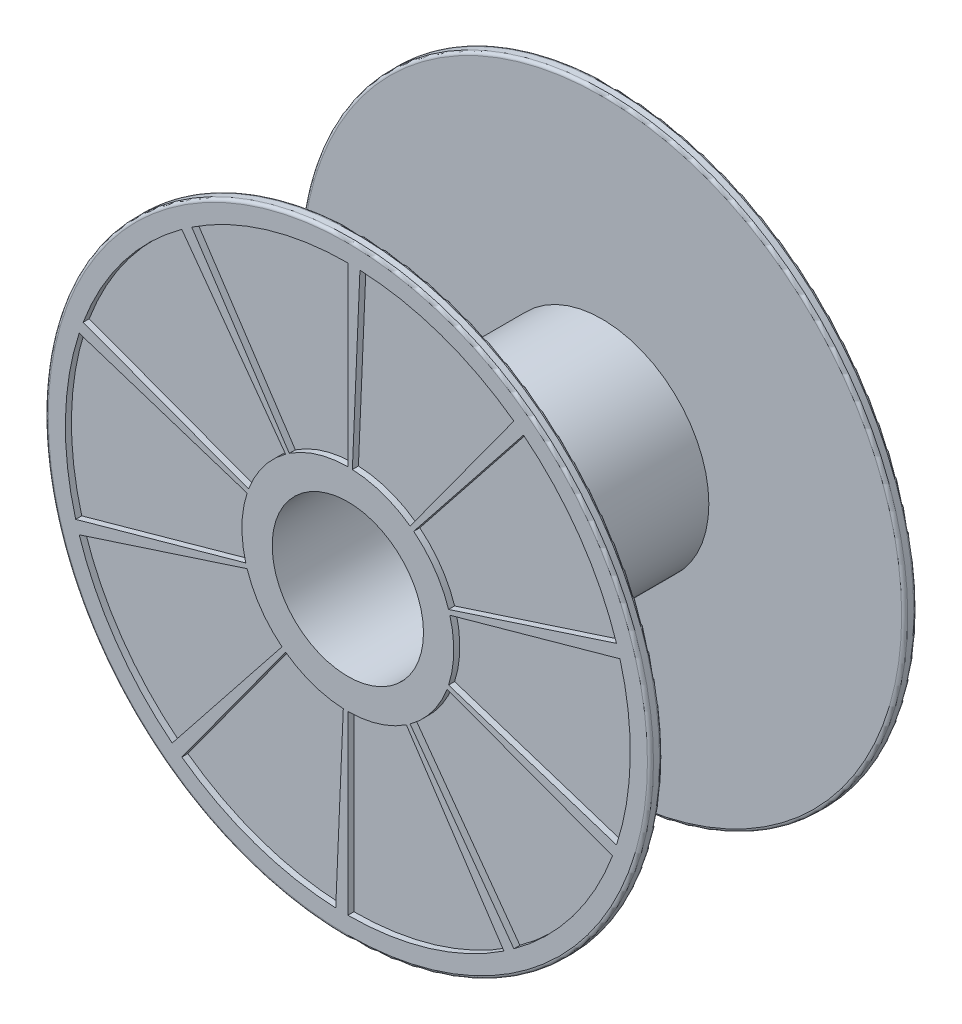
from build123d import *

# Parameters (mm, degrees)
SKICA1_R                 = 100
SKICA1_R_2               = 25
P_IDAT_VYSUNUT_M1_DEPTH  = 88
ODEBRAT_START            = -80
SKICA2_R                 = 100
SKICA2_R_2               = 35.288223769
ODEBRAT_VYSUNUT_M1_DEPTH = 80
ZAOBLIT1_R               = 1
ODEBRAT_VYSUNUT_M2_DEPTH = 2
ODEBRAT_START_2          = -2
ODEBRAT_VYSUNUT_M3_DEPTH = 2


with BuildPart() as part:
    # Skica1 → Přidat vysunutím1 (new body)
    with BuildSketch(Plane.XY):
        Circle(SKICA1_R)
        Circle(SKICA1_R_2, mode=Mode.SUBTRACT)
    extrude(amount=P_IDAT_VYSUNUT_M1_DEPTH)

    # Skica2 → Odebrat vysunutím1 (cut)
    with BuildSketch(Plane.XY.offset(84).offset(ODEBRAT_START)):
        Circle(SKICA2_R)
        Circle(SKICA2_R_2, mode=Mode.SUBTRACT)
    extrude(amount=ODEBRAT_VYSUNUT_M1_DEPTH, mode=Mode.SUBTRACT)

    # Zaoblit1
    zaoblit1_edges = [part.edges().sort_by_distance(p)[0] for p in [
        (-100, 0, 4),
        (-100, 0, 84),
        (-100, 0, 0),
        (-100, 0, 88),
    ]]
    fillet(zaoblit1_edges, radius=ZAOBLIT1_R)

    # Skica3 → Odebrat vysunutím2 (cut)
    with BuildSketch(Plane.XY.offset(88)):
        with BuildLine():
            Line((0, 35), (0, 93.333333333))
            ThreePointArc((0, 93.333333333), (-26.932410451, 89.363059361), (-51.573484154, 77.790017633))
            Line((-51.573484154, 77.790017633), (-19.340056558, 29.171256612))
            ThreePointArc((-19.340056558, 29.171256612), (-10.099653919, 33.51114726), (0, 35))
        make_face()
        with BuildLine():
            Line((-20.57248383, 28.315594803), (-54.859956881, 75.508252808))
            ThreePointArc((-54.859956881, 75.508252808), (-74.315066147, 56.465760021), (-87.44765028, 32.619312862))
            Line((-87.44765028, 32.619312862), (-32.792868855, 12.232242323))
            ThreePointArc((-32.792868855, 12.232242323), (-27.868149805, 21.174660008), (-20.57248383, 28.315594803))
        make_face()
        with BuildLine():
            ThreePointArc((54.859956881, 75.508252808), (30.737510638, 88.126707364), (4, 93.247579653))
            Line((4, 93.247579653), (1.5, 34.96784237))
            ThreePointArc((1.5, 34.96784237), (11.526566489, 33.047515262), (20.57248383, 28.315594803))
            Line((20.57248383, 28.315594803), (54.859956881, 75.508252808))
        make_face()
        with BuildLine():
            ThreePointArc((88.765274854, 28.841586142), (76.666747393, 53.228948471), (58.045620109, 73.087735614))
            Line((58.045620109, 73.087735614), (21.767107541, 27.407900855))
            ThreePointArc((21.767107541, 27.407900855), (28.750030272, 19.960855677), (33.28697807, 10.815594803))
            Line((33.28697807, 10.815594803), (88.765274854, 28.841586142))
        make_face()
        with BuildLine():
            ThreePointArc((93.333333333, 0), (92.476009032, 12.621365401), (89.919786235, 25.010860732))
            Line((89.919786235, 25.010860732), (33.719919838, 9.379072774))
            ThreePointArc((33.719919838, 9.379072774), (34.678503387, 4.733012025), (35, 0))
            ThreePointArc((35, 0), (34.569091921, -5.475206276), (33.28697807, -10.815594803))
            Line((33.28697807, -10.815594803), (88.765274854, -28.841586142))
            ThreePointArc((88.765274854, -28.841586142), (92.184245122, -14.60055007), (93.333333333, 0))
        make_face()
        with BuildLine():
            ThreePointArc((54.859956881, -75.508252808), (74.315066147, -56.465760021), (87.44765028, -32.619312862))
            Line((87.44765028, -32.619312862), (32.792868855, -12.232242323))
            ThreePointArc((32.792868855, -12.232242323), (27.868149805, -21.174660008), (20.57248383, -28.315594803))
            Line((20.57248383, -28.315594803), (54.859956881, -75.508252808))
        make_face()
        with BuildLine():
            ThreePointArc((0, -93.333333333), (26.932410451, -89.363059361), (51.573484154, -77.790017633))
            Line((51.573484154, -77.790017633), (19.340056558, -29.171256612))
            ThreePointArc((19.340056558, -29.171256612), (10.099653919, -33.51114726), (0, -35))
            Line((0, -35), (0, -93.333333333))
        make_face()
        with BuildLine():
            Line((-20.57248383, -28.315594803), (-54.859956881, -75.508252808))
            ThreePointArc((-54.859956881, -75.508252808), (-30.737510638, -88.126707364), (-4, -93.247579653))
            Line((-4, -93.247579653), (-1.5, -34.96784237))
            ThreePointArc((-1.5, -34.96784237), (-11.526566489, -33.047515262), (-20.57248383, -28.315594803))
        make_face()
        with BuildLine():
            Line((-33.28697807, -10.815594803), (-88.765274854, -28.841586142))
            ThreePointArc((-88.765274854, -28.841586142), (-76.666747393, -53.228948471), (-58.045620109, -73.087735614))
            Line((-58.045620109, -73.087735614), (-21.767107541, -27.407900855))
            ThreePointArc((-21.767107541, -27.407900855), (-28.750030272, -19.960855677), (-33.28697807, -10.815594803))
        make_face()
        with BuildLine():
            Line((-33.28697807, 10.815594803), (-88.765274854, 28.841586142))
            ThreePointArc((-88.765274854, 28.841586142), (-93.31189245, 2.000459553), (-89.919786235, -25.010860732))
            Line((-89.919786235, -25.010860732), (-33.719919838, -9.379072774))
            ThreePointArc((-33.719919838, -9.379072774), (-34.991959669, 0.750172332), (-33.28697807, 10.815594803))
        make_face()
    extrude(amount=-ODEBRAT_VYSUNUT_M2_DEPTH, mode=Mode.SUBTRACT)

    # Skica4 → Odebrat vysunutím3 (cut)
    with BuildSketch(Plane(origin=(0, 0, 0), x_dir=(-1, 0, 0), z_dir=(0, 0, -1)).offset(ODEBRAT_START_2)):
        with BuildLine():
            ThreePointArc((-19.340078903, 29.171241798), (-10.099666754, 33.511143392), (0, 35))
            Line((0, 35), (0, 93.335))
            ThreePointArc((0, 93.335), (-26.932925613, 89.364644815), (-51.574464697, 77.791367234))
            Line((-51.574464697, 77.791367234), (-19.340078903, 29.171241798))
        make_face()
        with BuildLine():
            ThreePointArc((-32.792878225, 12.232217204), (-27.868157915, 21.174649334), (-20.57248383, 28.315594803))
            Line((-20.57248383, 28.315594803), (-54.860936523, 75.50960117))
            ThreePointArc((-54.860936523, 75.50960117), (-74.316414828, 56.466739875), (-87.449236832, 32.619828364))
            Line((-87.449236832, 32.619828364), (-32.792878225, 12.232217204))
        make_face()
        with BuildLine():
            ThreePointArc((-33.719912654, -9.379098604), (-34.991959956, 0.750158931), (-33.28697807, 10.815594803))
            Line((-33.28697807, 10.815594803), (-88.766859948, 28.84210117))
            ThreePointArc((-88.766859948, 28.84210117), (-93.3135595, 2.000459537), (-89.921372787, -25.011376234))
            Line((-89.921372787, -25.011376234), (-33.719912654, -9.379098604))
        make_face()
        with BuildLine():
            ThreePointArc((-21.767086547, -27.407917529), (-28.750022627, -19.960866688), (-33.28697807, -10.815594803))
            Line((-33.28697807, -10.815594803), (-88.766859948, -28.84210117))
            ThreePointArc((-88.766859948, -28.84210117), (-76.668096055, -53.229928352), (-58.046600652, -73.089085216))
            Line((-58.046600652, -73.089085216), (-21.767086547, -27.407917529))
        make_face()
        with BuildLine():
            ThreePointArc((-1.499973215, -34.967843519), (-11.526553832, -33.047519676), (-20.57248383, -28.315594803))
            Line((-20.57248383, -28.315594803), (-54.860936523, -75.50960117))
            ThreePointArc((-54.860936523, -75.50960117), (-30.738025769, -88.128292828), (-4, -93.249247852))
            Line((-4, -93.249247852), (-1.499973215, -34.967843519))
        make_face()
        with BuildLine():
            Line((51.574464697, -77.791367234), (19.340078903, -29.171241798))
            ThreePointArc((19.340078903, -29.171241798), (10.099666754, -33.511143392), (0, -35))
            Line((0, -35), (0, -93.335))
            ThreePointArc((0, -93.335), (26.932925613, -89.364644815), (51.574464697, -77.791367234))
        make_face()
        with BuildLine():
            Line((87.449236832, -32.619828364), (32.792878225, -12.232217204))
            ThreePointArc((32.792878225, -12.232217204), (27.868157915, -21.174649334), (20.57248383, -28.315594803))
            Line((20.57248383, -28.315594803), (54.860936523, -75.50960117))
            ThreePointArc((54.860936523, -75.50960117), (74.316414828, -56.466739875), (87.449236832, -32.619828364))
        make_face()
        with BuildLine():
            Line((89.921372787, 25.011376234), (33.719912654, 9.379098604))
            ThreePointArc((33.719912654, 9.379098604), (34.678501574, 4.733025307), (35, 0))
            ThreePointArc((35, 0), (34.569091921, -5.475206276), (33.28697807, -10.815594803))
            Line((33.28697807, -10.815594803), (88.766859948, -28.84210117))
            ThreePointArc((88.766859948, -28.84210117), (92.185891269, -14.600810795), (93.335, 0))
            ThreePointArc((93.335, 0), (92.477655555, 12.621626201), (89.921372787, 25.011376234))
        make_face()
        with BuildLine():
            Line((58.046600652, 73.089085216), (21.767086547, 27.407917529))
            ThreePointArc((21.767086547, 27.407917529), (28.750022627, 19.960866688), (33.28697807, 10.815594803))
            Line((33.28697807, 10.815594803), (88.766859948, 28.84210117))
            ThreePointArc((88.766859948, 28.84210117), (76.668096055, 53.229928352), (58.046600652, 73.089085216))
        make_face()
        with BuildLine():
            Line((4, 93.249247852), (1.499973215, 34.967843519))
            ThreePointArc((1.499973215, 34.967843519), (11.526553832, 33.047519676), (20.57248383, 28.315594803))
            Line((20.57248383, 28.315594803), (54.860936523, 75.50960117))
            ThreePointArc((54.860936523, 75.50960117), (30.738025769, 88.128292828), (4, 93.249247852))
        make_face()
    extrude(amount=ODEBRAT_VYSUNUT_M3_DEPTH, mode=Mode.SUBTRACT)


solid = part.part
